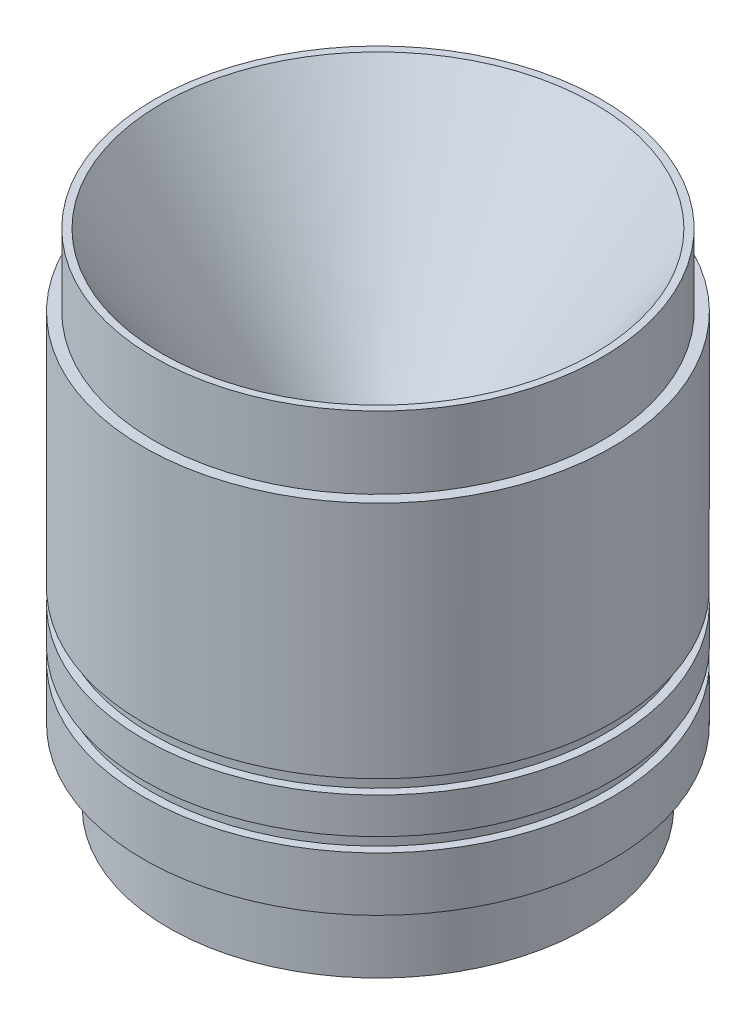
from build123d import *

# Parameters (mm, degrees)
SZKIC2_W = 2.3
SZKIC2_H = 3.9


with BuildPart() as part:
    # Szkic1 → Obrót1 (revolve)
    with BuildSketch(Plane.XY, mode=Mode.PRIVATE) as obr_t1_sk:
        Polygon((60, 64.358983849), (18.436392049, 5), (18.436392049, -5), (38.436392049, -79.641016151), (48, -79.641016151), (48, -74.641016151), (58, -74.641016151), (58, -54.641016151), (65, -54.641016151), (65, 44.358983849), (62, 44.358983849), (62, 64.358983849), align=None)
    revolve(obr_t1_sk.sketch.rotate(Axis((0, 60.824555965, 0), (0, -1, 0)), 180), axis=Axis((0, 60.824555965, 0), (0, -1, 0)))

    # Szkic2 → Wycięcie-obrót1 (revolve, cut)
    with BuildSketch(Plane.XY, mode=Mode.PRIVATE) as wyci_cie_obr_t1_sk:
        with Locations((63.85, -37.691016151)):
            Rectangle(SZKIC2_W, SZKIC2_H)
        with Locations((63.85, -23.791016151)):
            Rectangle(SZKIC2_W, SZKIC2_H)
    revolve(wyci_cie_obr_t1_sk.sketch.rotate(Axis((0, 85.874550226, 0), (0, -1, 0)), 90), axis=Axis((0, 85.874550226, 0), (0, -1, 0)), mode=Mode.SUBTRACT)


solid = part.part
